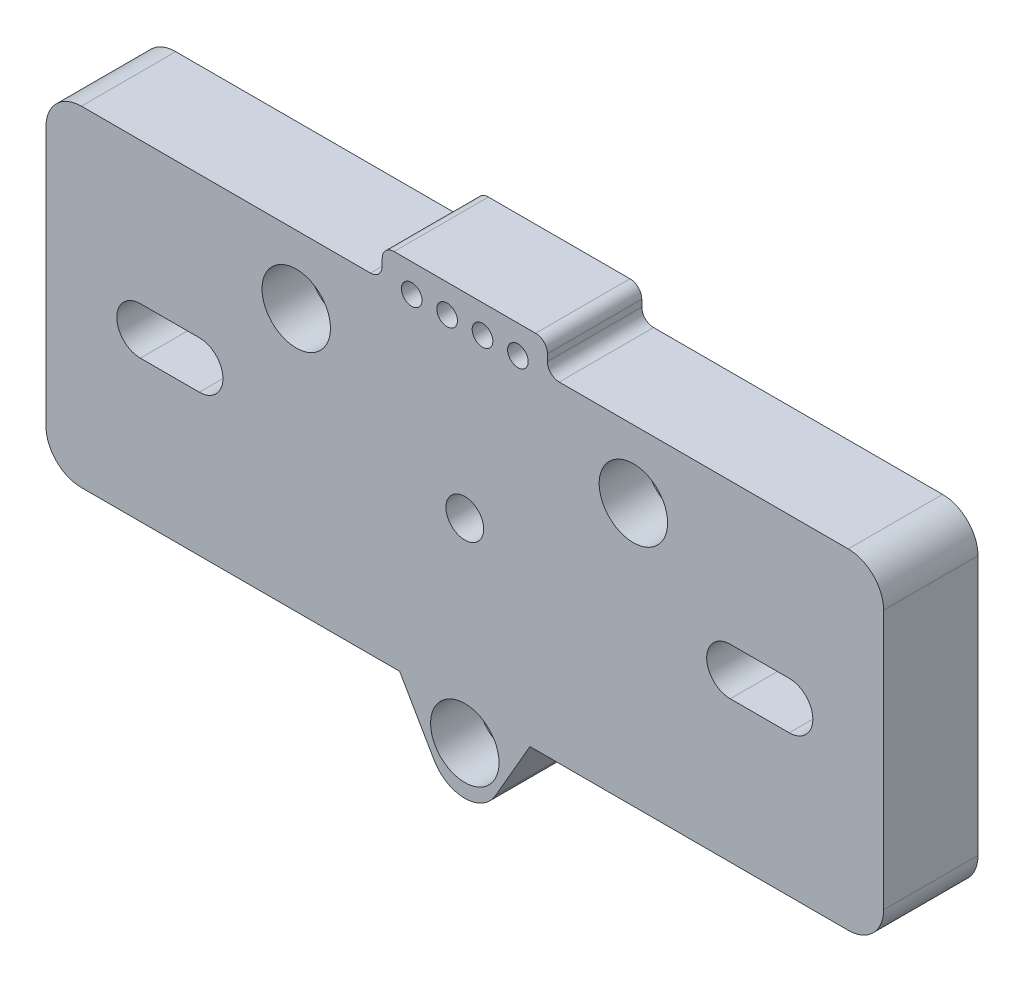
from build123d import *

# Parameters (mm, degrees)
MODEL_R             = 1.7499965
MODEL_R_2           = 1.6
BOSS_EXTRUDE1_DEPTH = 8
FILLET1_R           = 3
SKETCH1_R           = 0.875
SKETCH1_R_2         = 1.7499965
SKETCH1_R_3         = 1.6
BOSS_EXTRUDE2_DEPTH = 8
FILLET2_R           = 1
FILLET3_R           = 3
SKETCH2_R           = 2.9
CUT_EXTRUDE1_DEPTH  = 4
CHAMFER1_SIZE       = 1


with BuildPart() as part:
    # Model → Boss-Extrude1 (new body)
    with BuildSketch(Plane.XY):
        Polygon((20.40532142, 11.78), (-20.40532142, 11.78), (0, -23.563053444), align=None)
        with Locations((0, -16.5)):
            Circle(MODEL_R, mode=Mode.SUBTRACT)
        Circle(MODEL_R_2, mode=Mode.SUBTRACT)
        with Locations((-14.289419163, 8.25)):
            Circle(MODEL_R, mode=Mode.SUBTRACT)
        with Locations((14.289419163, 8.25)):
            Circle(MODEL_R, mode=Mode.SUBTRACT)
    extrude(amount=BOSS_EXTRUDE1_DEPTH)

    # Fillet1
    fillet1_edges = [part.edges().sort_by_distance(p)[0] for p in [
        (0, -23.563053444, 4),
        (-20.40532142, 11.78, 4),
        (20.40532142, 11.78, 4),
    ]]
    fillet(fillet1_edges, radius=FILLET1_R)

    # Sketch1 → Boss-Extrude2 (add)
    with BuildSketch(Plane(origin=(0, 0, 0), x_dir=(-1, 0, 0), z_dir=(0, 0, -1))):
        Polygon((-7, 16.58), (-7, 14), (-35.5, 14), (-35.5, -14), (-5.52123148, -14), (5.52123148, -14), (35.5, -14), (35.5, 14), (7, 14), (7, 16.58), align=None)
        with Locations((-1.5, 14.18)):
            Circle(SKETCH1_R, mode=Mode.SUBTRACT)
        with Locations((-4.5, 14.18)):
            Circle(SKETCH1_R, mode=Mode.SUBTRACT)
        with Locations((1.5, 14.18)):
            Circle(SKETCH1_R, mode=Mode.SUBTRACT)
        with Locations((4.5, 14.18)):
            Circle(SKETCH1_R, mode=Mode.SUBTRACT)
        with Locations(Location((-14.289419163, 8.25, 0), (0, 0, 180))):
            Circle(SKETCH1_R_2, mode=Mode.SUBTRACT)
        with Locations(Location((14.289419163, 8.25, 0), (0, 0, 180))):
            Circle(SKETCH1_R_2, mode=Mode.SUBTRACT)
        with Locations(Location((0, 0, 0), (0, 0, 180))):
            Circle(SKETCH1_R_3, mode=Mode.SUBTRACT)
        with BuildLine():
            Line((-27.5, 2), (-22.5, 2))
            ThreePointArc((-22.5, 2), (-20.5, 0), (-22.5, -2))
            Line((-22.5, -2), (-27.5, -2))
            ThreePointArc((-27.5, -2), (-29.5, 0), (-27.5, 2))
        make_face(mode=Mode.SUBTRACT)
        with BuildLine():
            Line((22.5, 2), (27.5, 2))
            ThreePointArc((27.5, 2), (29.5, 0), (27.5, -2))
            Line((27.5, -2), (22.5, -2))
            ThreePointArc((22.5, -2), (20.5, 0), (22.5, 2))
        make_face(mode=Mode.SUBTRACT)
    extrude(amount=-BOSS_EXTRUDE2_DEPTH)

    # Fillet2
    fillet2_edges = [part.edges().sort_by_distance(p)[0] for p in [
        (7, 16.58, 4),
        (-7, 16.58, 4),
        (-7, 14, 4),
        (7, 14, 4),
    ]]
    fillet(fillet2_edges, radius=FILLET2_R)

    # Fillet3
    fillet3_edges = [part.edges().sort_by_distance(p)[0] for p in [
        (-35.5, -14, 4),
        (-35.5, 14, 4),
        (35.5, -14, 4),
        (35.5, 14, 4),
    ]]
    fillet(fillet3_edges, radius=FILLET3_R)

    # Sketch2 → Cut-Extrude1 (cut)
    with BuildSketch(Plane.XY.offset(8)):
        with Locations((-14.289419163, 8.25)):
            Circle(SKETCH2_R)
        with Locations((14.289419163, 8.25)):
            Circle(SKETCH2_R)
        with Locations((0, -16.5)):
            Circle(SKETCH2_R)
    extrude(amount=-CUT_EXTRUDE1_DEPTH, mode=Mode.SUBTRACT)

    # Chamfer1
    chamfer1_edges = [part.edges().sort_by_distance(p)[0] for p in [
        (-1.6, 0, 0),
        (-16.039415663, 8.25, 0),
        (12.539422663, 8.25, 0),
        (-1.7499965, -16.5, 0),
    ]]
    chamfer(chamfer1_edges, length=CHAMFER1_SIZE)


solid = part.part
